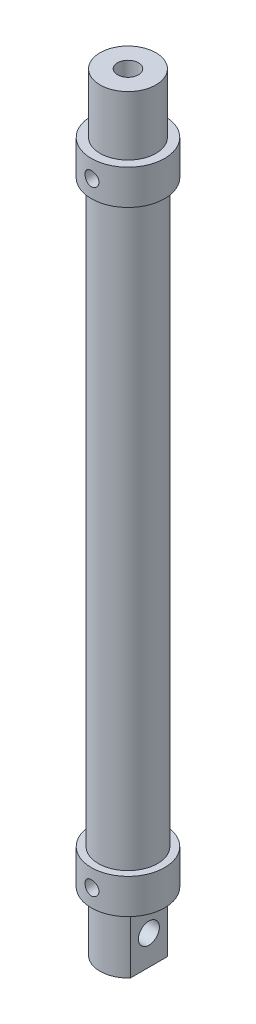
from build123d import *

# Parameters (mm, degrees)
SKETCH1_R           = 8
BOSS_EXTRUDE1_DEPTH = 17
SKETCH3_R           = 10.5
BOSS_EXTRUDE2_DEPTH = 10
SKETCH4_R           = 8.5
BOSS_EXTRUDE3_DEPTH = 166
SKETCH5_R           = 10.5
BOSS_EXTRUDE4_DEPTH = 10
SKETCH6_R           = 8
BOSS_EXTRUDE5_DEPTH = 17
CUT_EXTRUDE2_DEPTH  = 17
SKETCH8_R           = 3
CUT_EXTRUDE3_DEPTH  = 221.867607403
SKETCH9_R           = 3
CUT_EXTRUDE4_DEPTH  = 126
SKETCH10_R          = 2
CUT_EXTRUDE5_DEPTH  = 11


with BuildPart() as part:
    # Sketch1 → Boss-Extrude1 (new body)
    with BuildSketch(Plane(origin=(0, 0, 0), x_dir=(1, 0, 0), z_dir=(0, 1, 0))):
        with Locations(Location((0, 0, 0), (0, 0, 270))):
            Circle(SKETCH1_R)
    extrude(amount=BOSS_EXTRUDE1_DEPTH)

    # Sketch7 → Cut-Extrude2 (cut)
    with BuildSketch(Plane.XZ):
        with BuildLine():
            ThreePointArc((-6, 5.291502622), (-8, 0), (-6, -5.291502622))
            Line((-6, -5.291502622), (-6, 5.291502622))
        make_face()
        with BuildLine():
            Line((6, 5.291502622), (6, -5.291502622))
            ThreePointArc((6, -5.291502622), (7.483314774, -2.828427125), (8, 0))
            ThreePointArc((8, 0), (7.483314774, 2.828427125), (6, 5.291502622))
        make_face()
    extrude(amount=-CUT_EXTRUDE2_DEPTH, mode=Mode.SUBTRACT)

    # Sketch8 → Cut-Extrude3 (cut, through all)
    with BuildSketch(Plane.ZY.offset(6)):
        with Locations((0, 8.5)):
            Circle(SKETCH8_R)
    extrude(amount=-CUT_EXTRUDE3_DEPTH, mode=Mode.SUBTRACT)


with BuildPart() as body_2:
    # Sketch3 → Boss-Extrude2 (new body)
    with BuildSketch(Plane(origin=(0, 17, 0), x_dir=(1, 0, 0), z_dir=(0, 1, 0))):
        with Locations(Location((0, 0, 0), (0, 0, 270))):
            Circle(SKETCH3_R)
    extrude(amount=BOSS_EXTRUDE2_DEPTH)


with BuildPart() as body_3:
    # Sketch4 → Boss-Extrude3 (new body)
    with BuildSketch(Plane(origin=(0, 27, 0), x_dir=(1, 0, 0), z_dir=(0, 1, 0))):
        with Locations(Location((0, 0, 0), (0, 0, 270))):
            Circle(SKETCH4_R)
    extrude(amount=BOSS_EXTRUDE3_DEPTH)


with BuildPart() as body_4:
    # Sketch5 → Boss-Extrude4 (new body)
    with BuildSketch(Plane(origin=(0, 193, 0), x_dir=(1, 0, 0), z_dir=(0, 1, 0))):
        with Locations(Location((0, 0, 0), (0, 0, 270))):
            Circle(SKETCH5_R)
    extrude(amount=BOSS_EXTRUDE4_DEPTH)


with BuildPart() as body_5:
    # Sketch6 → Boss-Extrude5 (new body)
    with BuildSketch(Plane(origin=(0, 203, 0), x_dir=(1, 0, 0), z_dir=(0, 1, 0))):
        with Locations(Location((0, 0, 0), (0, 0, 270))):
            Circle(SKETCH6_R)
    extrude(amount=BOSS_EXTRUDE5_DEPTH)


with BuildPart() as cut_extrude4_tool:
    # Sketch9 → Cut-Extrude4 (new body)
    with BuildSketch(Plane(origin=(0, 220, 0), x_dir=(1, 0, 0), z_dir=(0, 1, 0))):
        with Locations(Location((0, 0, 0), (0, 0, 270))):
            Circle(SKETCH9_R)
    extrude(amount=-CUT_EXTRUDE4_DEPTH)


with BuildPart() as body_3_1:
    add(body_3.part)

    # Cut-Extrude4: cut by cut_extrude4_tool
    add(cut_extrude4_tool.part, mode=Mode.SUBTRACT)


with BuildPart() as body_4_1:
    add(body_4.part)

    # Cut-Extrude4: cut by cut_extrude4_tool
    add(cut_extrude4_tool.part, mode=Mode.SUBTRACT)


with BuildPart() as body_5_1:
    add(body_5.part)

    # Cut-Extrude4: cut by cut_extrude4_tool
    add(cut_extrude4_tool.part, mode=Mode.SUBTRACT)


with BuildPart() as cut_extrude5_tool:
    # Sketch10 → Cut-Extrude5 (new body)
    with BuildSketch(Plane.XY):
        with Locations(Location((0, 198, 0), (0, 0, 270))):
            Circle(SKETCH10_R)
        with Locations(Location((0, 22, 0), (0, 0, 180))):
            Circle(SKETCH10_R)
    extrude(amount=CUT_EXTRUDE5_DEPTH)


with BuildPart() as body_2_1:
    add(body_2.part)

    # Cut-Extrude5: cut by cut_extrude5_tool
    add(cut_extrude5_tool.part, mode=Mode.SUBTRACT)


with BuildPart() as body_4_2:
    add(body_4_1.part)

    # Cut-Extrude5: cut by cut_extrude5_tool
    add(cut_extrude5_tool.part, mode=Mode.SUBTRACT)


solid = Compound([part.part, body_3_1.part, body_5_1.part, body_2_1.part, body_4_2.part])
